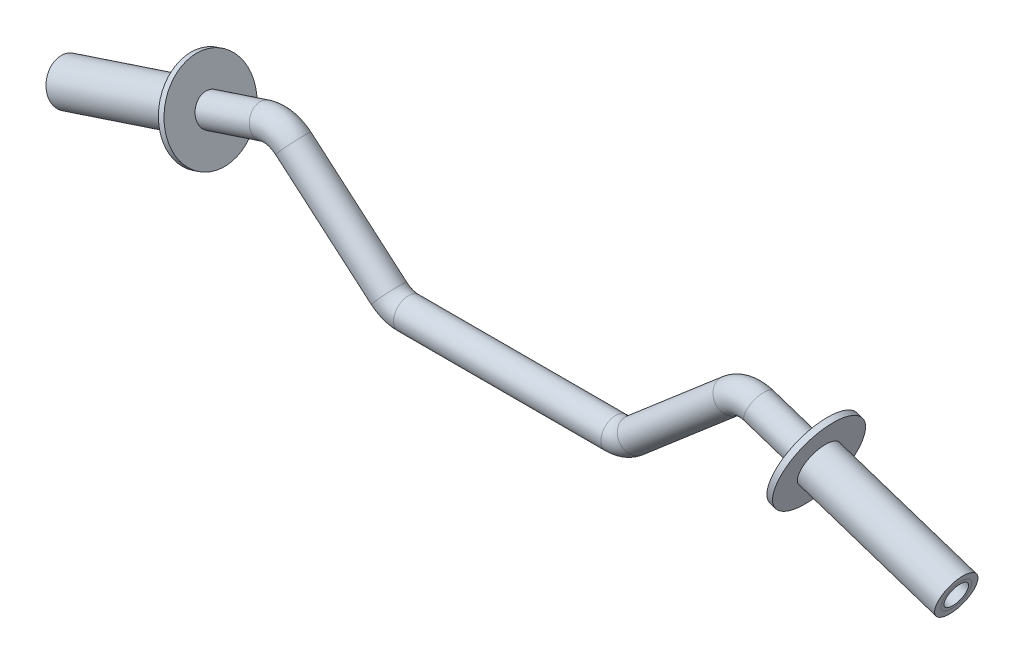
from build123d import *

# Parameters (mm, degrees)
SKETCH2_R   = 10
SKETCH2_R_2 = 8


with BuildPart() as part:
    # Sweep1: sweep along a path in Sketch1
    with BuildLine(Plane.XY) as sweep1_path:
        Line((0, 0), (70, 0))
        ThreePointArc((70, 0), (76.93953609, 1.242525787), (83.016816926, 4.815716114))
        Line((83.016816926, 4.815716114), (147.604961339, 60.184283886))
        ThreePointArc((147.604961339, 60.184283886), (156.75138781, 64.621928491), (166.897824545, 63.989766799))
        Line((166.897824545, 63.989766799), (300, 20))
    # Sketch2 → Sweep1 (sweep)
    with BuildSketch(Plane(origin=(0, 0, 0), x_dir=(0, 0, -1), z_dir=(1, 0, 0))):
        Circle(SKETCH2_R)
        Circle(SKETCH2_R_2, mode=Mode.SUBTRACT)
    sweep(path=sweep1_path.line)


with BuildPart() as body_2:
    # Sketch3 → Revolve1 (revolve)
    with BuildSketch(Plane(origin=(143.301270189, 55, 0), x_dir=(-0.86602540378444, 0.4999999999999978, 0), z_dir=(0, 0, 1))):
        Polygon((-155.2349147, -38.246653973), (-55.750005212, -17.623541111), (-59.809673098, 1.960102489), (-63.726401818, 1.148168912), (-60.478667509, -14.518745968), (-156.046848277, -34.329925253), align=None)
    revolve(axis=Axis((300, 20, 0), (-0.9494883399700914, 0.3138023139826093, 0)))


with BuildPart() as body_3:
    # Mirror1: mirrored copy
    add(part.part.mirror(Plane(origin=(0, 0, 0), x_dir=(0, 0, 1), z_dir=(1, 0, 0))))

    # Combine1: union part
    add(part.part)


with BuildPart() as body_4:
    # Mirror1 2: mirrored copy
    add(body_2.part.mirror(Plane(origin=(0, 0, 0), x_dir=(0, 0, 1), z_dir=(1, 0, 0))))


solid = Compound([body_2.part, body_3.part, body_4.part])
